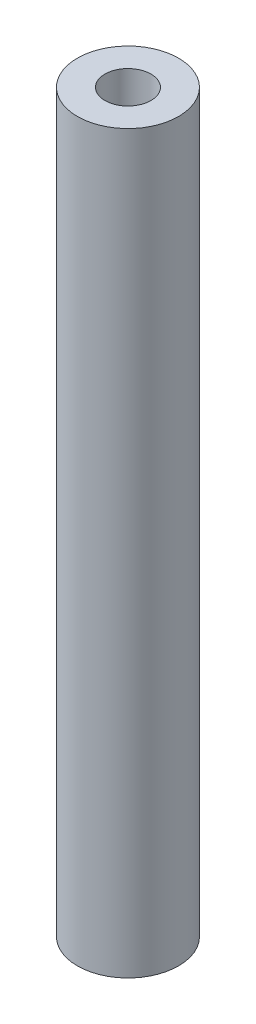
from build123d import *

# Parameters (mm, degrees)
SKETCH_1_R      = 2.75
SKETCH_1_R_2    = 1.25
EXTRUDE_1_DEPTH = 40


with BuildPart() as part:
    # 草图1 → 凸台-拉伸1 (new body)
    with BuildSketch(Plane(origin=(0, 0, 0), x_dir=(1, 0, 0), z_dir=(0, 1, 0))):
        with Locations(Location((0, 0, 0), (0, 0, 270))):
            Circle(SKETCH_1_R)
        with Locations(Location((0, 0, 0), (0, 0, 270))):
            Circle(SKETCH_1_R_2, mode=Mode.SUBTRACT)
    extrude(amount=EXTRUDE_1_DEPTH)


solid = part.part
